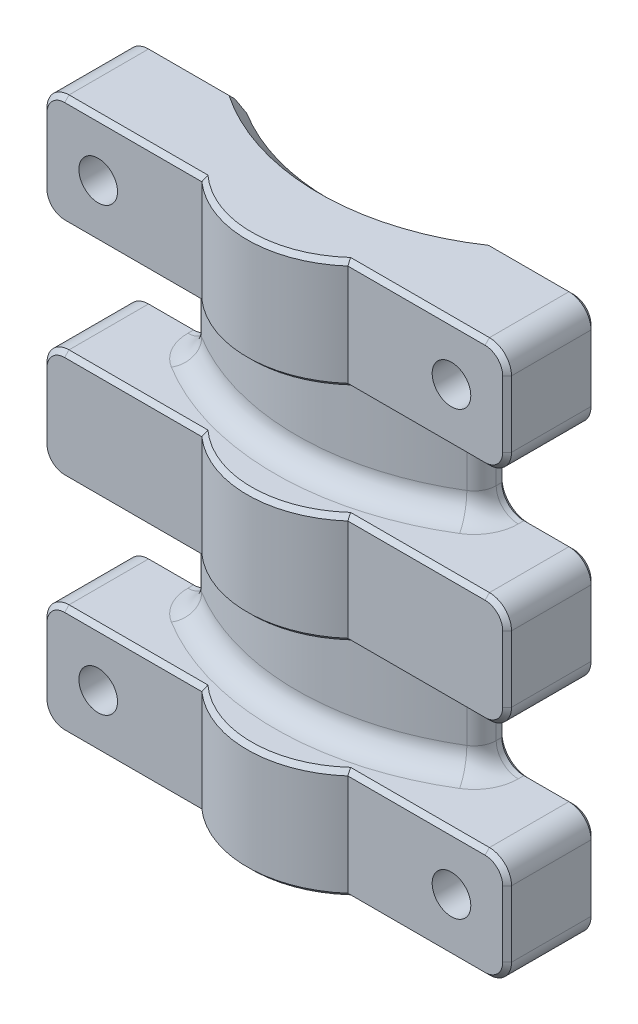
from build123d import *

# Parameters (mm, degrees)
BOSS_EXTRUDE1_START = 25
BOSS_EXTRUDE1_DEPTH = 50
SKETCH2_R           = 1.75
CUT_EXTRUDE1_DEPTH  = 35.321312345
CUT_EXTRUDE2_START  = -5
CUT_EXTRUDE2_DEPTH  = 10
CHAMFER1_SIZE       = 2
CHAMFER2_SIZE       = 1
FILLET1_R           = 2
FILLET3_R           = 2
CHAMFER4_SIZE       = 0.4
FILLET2_R           = 2
CHAMFER5_SIZE       = 0.4


with BuildPart() as part:
    # Sketch1 → Boss-Extrude1 (new body)
    with BuildSketch(Plane(origin=(0, 0, 0), x_dir=(1, 0, 0), z_dir=(0, 1, 0)).offset(BOSS_EXTRUDE1_START)):
        with BuildLine():
            Line((-21.040496218, 41), (-10.535653753, 41))
            ThreePointArc((-10.535653753, 41), (0, 38), (10.535653753, 41))
            Line((10.535653753, 41), (21.040496218, 41))
            Line((21.040496218, 41), (21.040496218, 33))
            Line((21.040496218, 33), (6.614378278, 33))
            ThreePointArc((6.614378278, 33), (0, 30.5), (-6.614378278, 33))
            Line((-6.614378278, 33), (-21.040496218, 33))
            Line((-21.040496218, 33), (-21.040496218, 41))
        make_face()
    extrude(amount=-BOSS_EXTRUDE1_DEPTH)

    # Sketch2 → Cut-Extrude1 (cut, through all)
    with BuildSketch(Plane(origin=(0, 0, -41), x_dir=(-1, 0, 0), z_dir=(0, 0, -1))):
        with Locations((-16, 20)):
            Circle(SKETCH2_R)
        with Locations((16, 20)):
            Circle(SKETCH2_R)
        with Locations((-16, -20)):
            Circle(SKETCH2_R)
        with Locations((16, -20)):
            Circle(SKETCH2_R)
    extrude(amount=-CUT_EXTRUDE1_DEPTH, mode=Mode.SUBTRACT)

    # Sketch3 → Cut-Extrude2 (cut)
    with BuildSketch(Plane(origin=(0, 0, 0), x_dir=(1, 0, 0), z_dir=(0, 1, 0)).offset(CUT_EXTRUDE2_START)):
        with BuildLine():
            Line((-21.040496218, 41), (-21.040496218, 8.382266622))
            Line((-21.040496218, 8.382266622), (21.040496218, 8.382266622))
            Line((21.040496218, 8.382266622), (21.040496218, 41))
            Line((21.040496218, 41), (12.961481397, 41))
            Line((12.961481397, 41), (12.961481397, 39))
            ThreePointArc((12.961481397, 39), (0, 35), (-12.961481397, 39))
            Line((-12.961481397, 39), (-12.961481397, 41))
            Line((-12.961481397, 41), (-21.040496218, 41))
        make_face()
    cut_extrude2 = extrude(amount=-CUT_EXTRUDE2_DEPTH, mode=Mode.SUBTRACT)

    # Mirror1: Cut-Extrude2 across plane
    add(cut_extrude2.mirror(Plane.ZX), mode=Mode.SUBTRACT)

    # Chamfer1
    chamfer1_edges = [part.edges().sort_by_distance(p)[0] for p in [
        (-14.25, 20, -41),
        (17.75, -20, -41),
        (-14.25, -20, -41),
        (17.75, 20, -41),
    ]]
    chamfer(chamfer1_edges, length=CHAMFER1_SIZE)

    # Chamfer2
    chamfer2_edges = [part.edges().sort_by_distance(p)[0] for p in [
        (0, -25, -38),
        (0, 25, -38),
    ]]
    chamfer(chamfer2_edges, length=CHAMFER2_SIZE)

    # Fillet1
    fillet1_edges = [part.edges().sort_by_distance(p)[0] for p in [
        (-21.040496218, 25, -37),
        (21.040496218, 25, -37),
        (-21.040496218, -25, -37),
        (21.040496218, -25, -37),
        (-21.040496218, -15, -37),
        (21.040496218, -15, -37),
        (21.040496218, -5, -37),
        (-21.040496218, -5, -37),
        (21.040496218, 5, -37),
        (21.040496218, 15, -37),
        (-21.040496218, 5, -37),
        (-21.040496218, 15, -37),
    ]]
    fillet(fillet1_edges, radius=FILLET1_R)

    # Fillet3
    fillet3_edges = [part.edges().sort_by_distance(p)[0] for p in [
        (-12.961481397, -10, -39),
        (12.961481397, -10, -39),
        (12.961481397, 10, -39),
        (-12.961481397, 10, -39),
    ]]
    fillet(fillet3_edges, radius=FILLET3_R)

    # Chamfer4
    chamfer4_edges = [part.edges().sort_by_distance(p)[0] for p in [
        (-21.040496218, 20, -33),
        (-12.827437248, 15, -33),
        (-12.827437248, 25, -33),
        (-20.45470978, 24.414213562, -33),
        (-20.45470978, 15.585786438, -33),
        (-12.827437248, 5, -33),
        (-21.040496218, 0, -33),
        (-20.45470978, -4.414213562, -33),
        (-20.45470978, 4.414213562, -33),
        (12.827437248, -5, -33),
        (12.827437248, -15, -33),
        (-21.040496218, -20, -33),
        (-12.827437248, -25, -33),
        (-20.45470978, -24.414213562, -33),
        (-20.45470978, -15.585786438, -33),
        (21.040496218, -20, -33),
        (20.45470978, -15.585786438, -33),
        (20.45470978, -24.414213562, -33),
        (21.040496218, 0, -33),
        (20.45470978, 4.414213562, -33),
        (20.45470978, -4.414213562, -33),
        (21.040496218, 20, -33),
        (20.45470978, 24.414213562, -33),
        (20.45470978, 15.585786438, -33),
        (12.827437248, 25, -33),
        (0, 25, -30.5),
        (12.827437248, -25, -33),
        (0, -25, -30.5),
        (0, -15, -30.5),
        (-12.827437248, -5, -33),
        (-12.827437248, -15, -33),
        (0, -5, -30.5),
        (0, 15, -30.5),
        (12.827437248, 5, -33),
        (12.827437248, 15, -33),
        (0, 5, -30.5),
    ]]
    chamfer(chamfer4_edges, length=CHAMFER4_SIZE)

    # Fillet2
    fillet2_edges = [part.edges().sort_by_distance(p)[0] for p in [
        (0, 5, -35),
        (0, 15, -35),
        (0, -5, -35),
        (0, -15, -35),
        (-12.961481397, -5, -40.543913723),
        (-12.961481397, -15, -40.543913723),
        (-12.961481397, 5, -40.543913723),
        (-12.961481397, 15, -40.543913723),
        (12.706173521, 5, -39.110049665),
        (12.706173521, 15, -39.110049665),
        (12.706173521, -5, -39.110049665),
        (12.706173521, -15, -39.110049665),
        (-12.706173521, -5, -39.110049665),
        (-12.706173521, -15, -39.110049665),
        (-12.706173521, 5, -39.110049665),
        (-12.706173521, 15, -39.110049665),
        (12.961481397, -15, -40.543913723),
        (12.961481397, -5, -40.543913723),
        (12.961481397, 5, -40.543913723),
        (12.961481397, 15, -40.543913723),
    ]]
    fillet(fillet2_edges, radius=FILLET2_R)

    # Chamfer5
    chamfer5_edges = [part.edges().sort_by_distance(p)[0] for p in [
        (-15.684662112, -25, -41),
        (-20.45470978, -24.414213562, -41),
        (-21.040496218, -20, -41),
        (-20.45470978, -15.585786438, -41),
        (-17.000988807, -15, -41),
        (-13.547267834, -14.414213562, -41),
        (-12.961481397, -10, -41),
        (-13.547267834, -5.585786438, -41),
        (-17.000988807, -5, -41),
        (-20.45470978, -4.414213562, -41),
        (-21.040496218, 0, -41),
        (-20.45470978, 4.414213562, -41),
        (-17.000988807, 5, -41),
        (-13.547267834, 5.585786438, -41),
        (-12.961481397, 10, -41),
        (-13.547267834, 14.414213562, -41),
        (-17.000988807, 15, -41),
        (-20.45470978, 15.585786438, -41),
        (-21.040496218, 20, -41),
        (-20.45470978, 24.414213562, -41),
        (-15.684662112, 25, -41),
        (15.684662112, -25, -41),
        (20.45470978, -24.414213562, -41),
        (21.040496218, -20, -41),
        (20.45470978, -15.585786438, -41),
        (17.000988807, -15, -41),
        (13.547267834, -14.414213562, -41),
        (12.961481397, -10, -41),
        (13.547267834, -5.585786438, -41),
        (17.000988807, -5, -41),
        (20.45470978, -4.414213562, -41),
        (21.040496218, 0, -41),
        (20.45470978, 4.414213562, -41),
        (17.000988807, 5, -41),
        (13.547267834, 5.585786438, -41),
        (12.961481397, 10, -41),
        (13.547267834, 14.414213562, -41),
        (17.000988807, 15, -41),
        (20.45470978, 15.585786438, -41),
        (21.040496218, 20, -41),
        (20.45470978, 24.414213562, -41),
        (15.684662112, 25, -41),
    ]]
    chamfer(chamfer5_edges, length=CHAMFER5_SIZE)


solid = part.part
